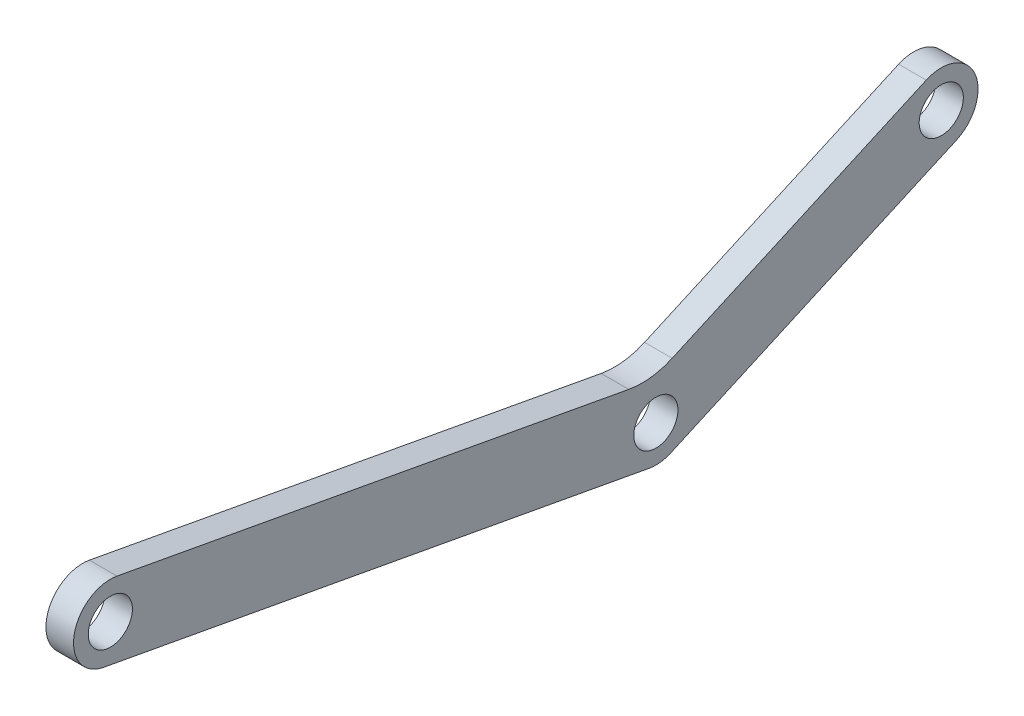
from build123d import *

# Parameters (mm, degrees)
BOSS_EXTRUDE1_START = -788.875
SKETCH17_R          = 12
BOSS_EXTRUDE1_DEPTH = 15


with BuildPart() as part:
    # Sketch17 → Boss-Extrude1 (new body)
    with BuildSketch(Plane(origin=(0, 0, 0), x_dir=(0, 0, -1), z_dir=(1, 0, 0)).offset(BOSS_EXTRUDE1_START)):
        with BuildLine():
            Line((-548.029172215, -53.980377733), (-269.874698755, -105.175012144))
            ThreePointArc((-269.874698755, -105.175012144), (-257.859567394, -105.549773141), (-246.27566259, -102.337768013))
            Line((-246.27566259, -102.337768013), (-108.179302637, -40.448999798))
            ThreePointArc((-108.179302637, -40.448999798), (-81.748999798, -50.520697363), (-91.820697363, -76.951000202))
            Line((-91.820697363, -76.951000202), (-246.954199078, -146.47507262))
            ThreePointArc((-246.954199078, -146.47507262), (-252.74615148, -148.081075184), (-258.75371716, -147.893694685))
            Line((-258.75371716, -147.893694685), (-555.269603105, -93.319622267))
            ThreePointArc((-555.269603105, -93.319622267), (-571.319009927, -70.029784555), (-548.029172215, -53.980377733))
        make_face()
        with Locations((-100, -58.7)):
            Circle(SKETCH17_R, mode=Mode.SUBTRACT)
        with Locations((-255.133501715, -128.224072418)):
            Circle(SKETCH17_R, mode=Mode.SUBTRACT)
        with Locations((-551.64938766, -73.65)):
            Circle(SKETCH17_R, mode=Mode.SUBTRACT)
    extrude(amount=BOSS_EXTRUDE1_DEPTH)


solid = part.part
